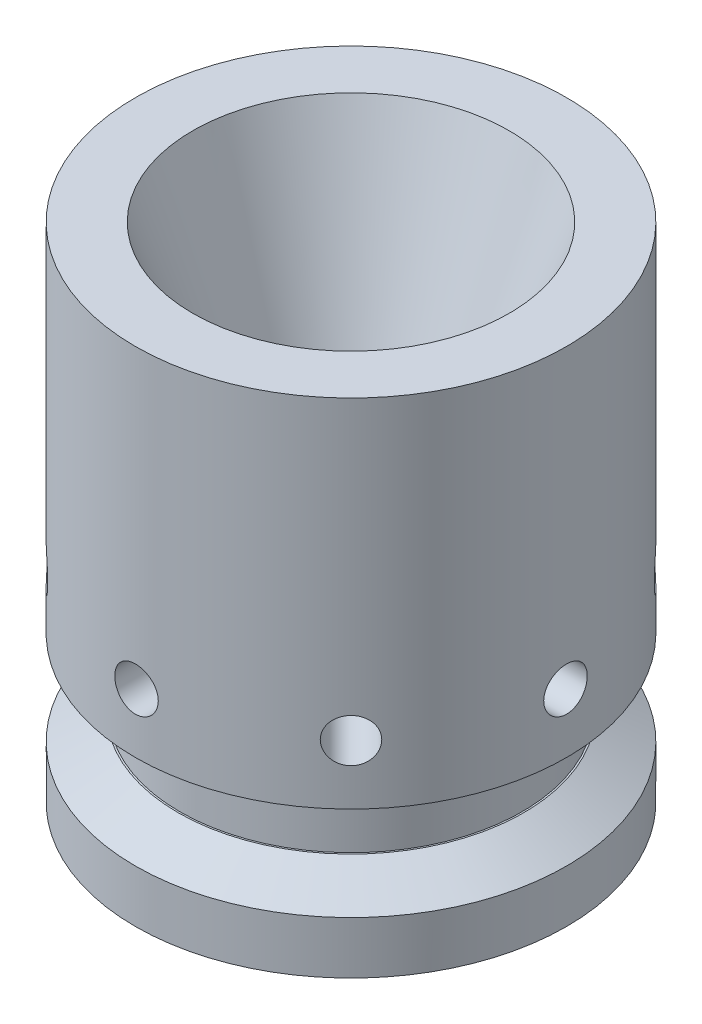
from build123d import *

# Parameters (mm, degrees)
SKETCH3_R          = 1.1
CUT_EXTRUDE1_DEPTH = 6
CIRPATTERN1_COUNT  = 8
CHAMFER2_SIZE      = 1.25
CHAMFER2_SIZE2     = 2.165063509


with BuildPart() as part:
    # Sketch2 → Revolve1 (revolve)
    with BuildSketch(Plane.XY):
        Polygon((-2.5, 0), (-2.5, 2), (-8, 17), (-10.9, 17), (-10.9, 2), (-10.9, -1), (-8.65, -1), (-8.65, -4.5), (-10.9, -4.5), (-10.9, -8.4), align=None)
    revolve(axis=Axis((0, 19.141519074, 0), (0, -1, 0)))

    # Sketch3 → Cut-Extrude1 (cut)
    with BuildSketch(Plane.ZY.offset(10.9)):
        with Locations((0, 2)):
            Circle(SKETCH3_R)
    cut_extrude1 = extrude(amount=-CUT_EXTRUDE1_DEPTH, mode=Mode.SUBTRACT)

    # CirPattern1: Cut-Extrude1 ×8 about axis
    cirpattern1_axis = Axis((0, 0, 0), (0, 1, 0))
    for i in range(1, CIRPATTERN1_COUNT):
        add(cut_extrude1.rotate(cirpattern1_axis, i * 360 / CIRPATTERN1_COUNT), mode=Mode.SUBTRACT)

    # Chamfer2
    chamfer2_edges = [part.edges().sort_by_distance(p)[0] for p in [
        (10.9, -4.5, 0),
    ]]
    chamfer2_side = [part.faces().sort_by_distance(p)[0] for p in [
        (10.9, -6.45, 0),
    ]]
    chamfer(chamfer2_edges, length=CHAMFER2_SIZE, length2=CHAMFER2_SIZE2, reference=chamfer2_side[0])


solid = part.part
